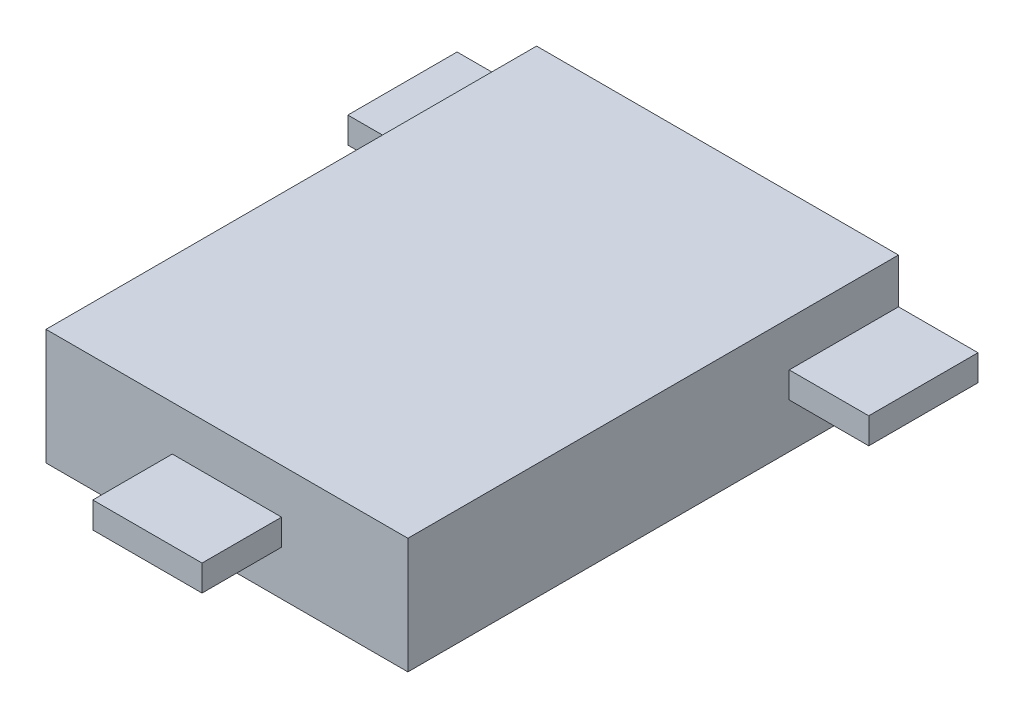
from build123d import *

# Parameters (mm, degrees)
SKETCH1_W           = 25.01
SKETCH1_H           = 33.905
BOSS_EXTRUDE1_DEPTH = 8
SKETCH2_W           = 7.55
SKETCH2_H           = 1.8
BOSS_EXTRUDE2_DEPTH = 5.495
SKETCH3_W           = 7.55
SKETCH3_H           = 1.8
BOSS_EXTRUDE3_DEPTH = 5.495


with BuildPart() as part:
    # Sketch1 → Boss-Extrude1 (new body)
    with BuildSketch(Plane(origin=(0, 0, 0), x_dir=(1, 0, 0), z_dir=(0, 1, 0))):
        Rectangle(SKETCH1_W, SKETCH1_H)
    extrude(amount=BOSS_EXTRUDE1_DEPTH)

    # Sketch2 → Boss-Extrude2 (add)
    with BuildSketch(Plane.XY.offset(16.9525)):
        with Locations((0, 4)):
            Rectangle(SKETCH2_W, SKETCH2_H)
    extrude(amount=BOSS_EXTRUDE2_DEPTH)

    # Sketch3 → Boss-Extrude3 (add)
    with BuildSketch(Plane.ZY.offset(12.505)):
        with Locations((-13.1775, 4)):
            Rectangle(SKETCH3_W, SKETCH3_H)
    boss_extrude3 = extrude(amount=BOSS_EXTRUDE3_DEPTH)

    # Mirror2: Boss-Extrude3 across plane
    add(boss_extrude3.mirror(Plane(origin=(0, 0, 0), x_dir=(0, 0, 1), z_dir=(1, 0, 0))))


solid = part.part
